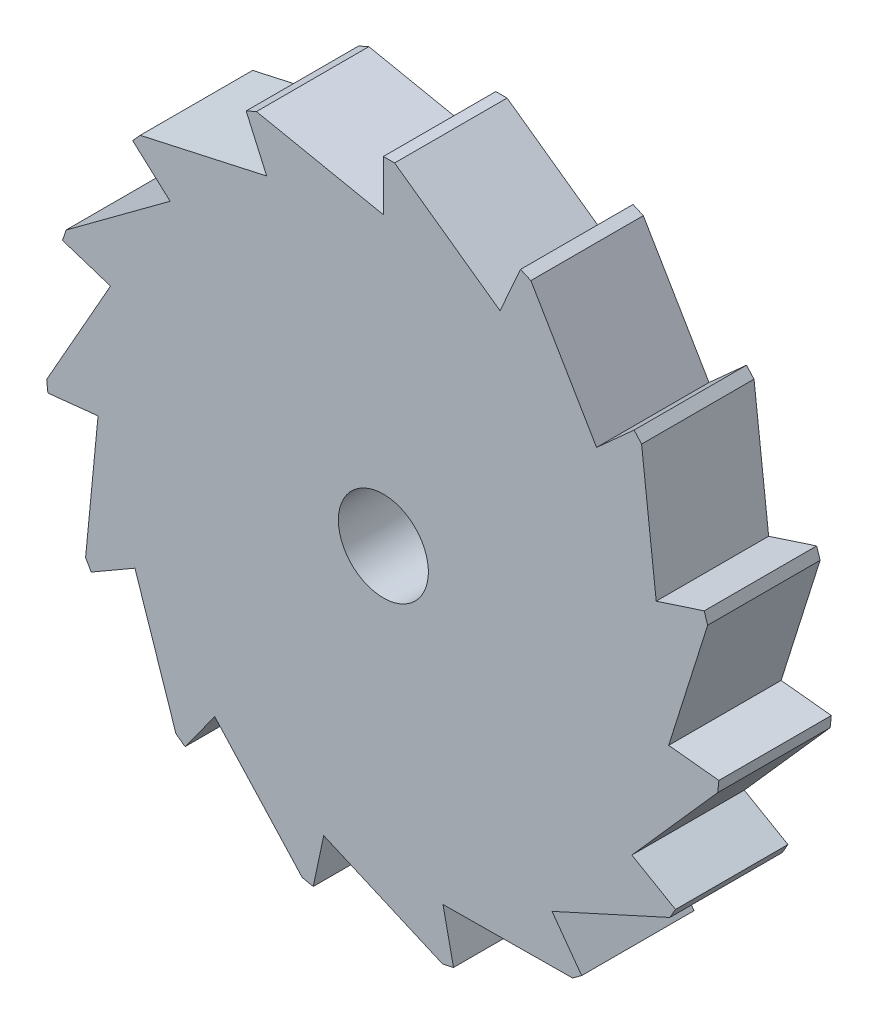
from build123d import *

# Parameters (mm, degrees)
BOSS_EXTRUDE2_DEPTH = 10
SKETCH2_R           = 4
CUT_EXTRUDE1_DEPTH  = 10


with BuildPart() as part:
    # Sketch1 → Boss-Extrude2 (new body)
    with BuildSketch(Plane.XY):
        Polygon((0, 25.51264103), (0, 30), (1.000891574, 30), (10.376925968, 23.306957325), (12.202099292, 27.406363729), (13.116459243, 26.99926445), (18.959587166, 17.071288962), (22.294344764, 20.073918191), (22.96407195, 19.330110797), (24.263963499, 7.88383965), (28.531695489, 9.270509831), (28.840987995, 8.318605378), (25.372880113, -2.666797161), (29.835656861, -3.135853898), (29.731035203, -4.131262483), (22.094595249, -12.756320515), (25.980762114, -15), (25.480316326, -15.86679753), (14.995954144, -20.640160164), (17.633557569, -24.270509831), (16.823819276, -24.858819138), (5.304376334, -24.955128612), (6.237350725, -29.344428022), (5.258331033, -29.552525082), (-5.304376334, -24.955128612), (-6.237350725, -29.344428022), (-7.216370416, -29.136330963), (-14.995954144, -20.640160164), (-17.633557569, -24.270509831), (-18.443295862, -23.682200525), (-22.094595249, -12.756320515), (-25.980762114, -15), (-26.481207901, -14.13320247), (-25.372880113, -2.666797161), (-29.835656861, -3.135853898), (-29.940278519, -2.140445313), (-24.263963499, 7.88383965), (-28.531695489, 9.270509831), (-28.222402983, 10.222414285), (-18.959587165, 17.071288962), (-22.294344764, 20.073918191), (-21.624617578, 20.817725585), (-10.376925968, 23.306957325), (-12.202099292, 27.406363729), (-11.287739341, 27.813463008), align=None)
    extrude(amount=BOSS_EXTRUDE2_DEPTH)

    # Sketch2 → Cut-Extrude1 (cut)
    with BuildSketch(Plane(origin=(0, 0, 0), x_dir=(-1, 0, 0), z_dir=(0, 0, -1))):
        Circle(SKETCH2_R)
    extrude(amount=-CUT_EXTRUDE1_DEPTH, mode=Mode.SUBTRACT)


solid = part.part
